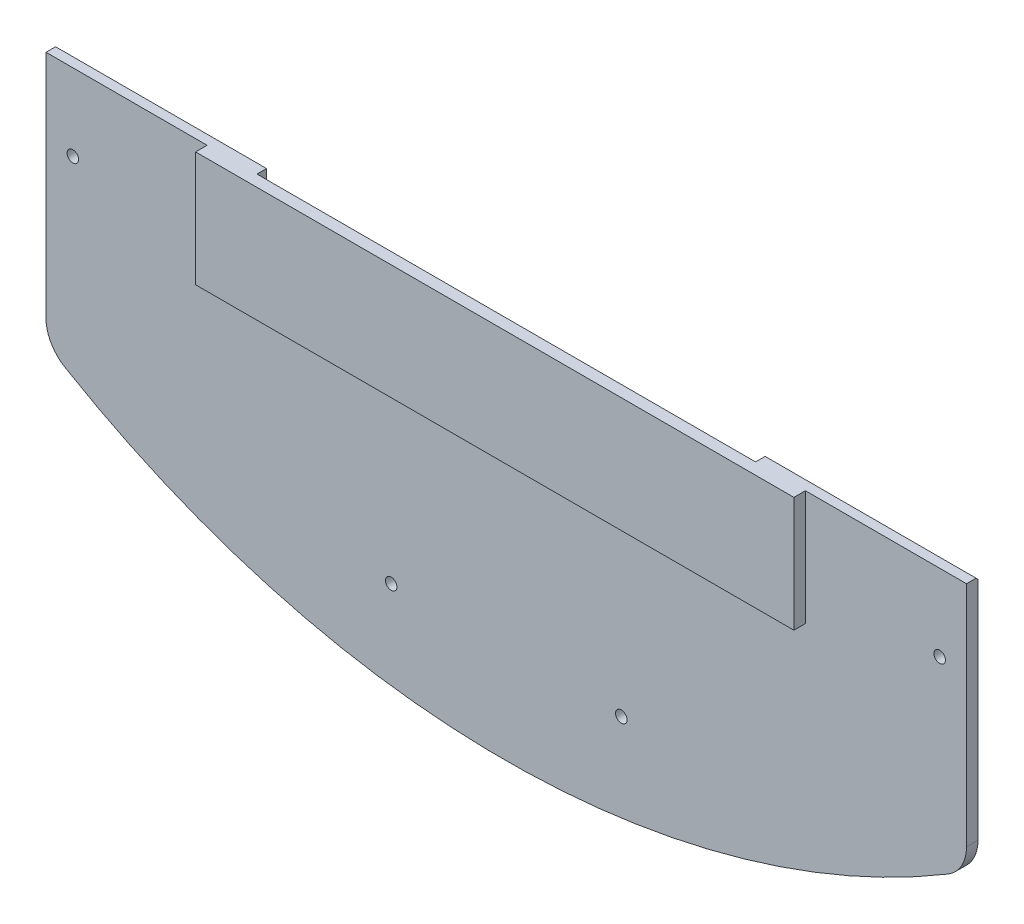
from build123d import *

# Parameters (mm, degrees)
EXTRUDE_1_DEPTH     = 3
SKETCH_2_W          = 156
SKETCH_2_H          = 30
EXTRUDE_2_DEPTH     = 3
SKETCH_3_R          = 1.5
CUT_EXTRUDE_1_DEPTH = 3
SKETCH_4_W          = 130
SKETCH_4_H          = 20
CUT_EXTRUDE_2_DEPTH = 3
FILLET_1_R          = 10
CHAMFER_1_SIZE      = 0.5


with BuildPart() as part:
    # 草图1 → 凸台-拉伸1 (new body)
    with BuildSketch(Plane.XY):
        with BuildLine():
            Line((-120, -25), (120, -25))
            Line((120, -25), (120, -90))
            ThreePointArc((120, -90), (0.09506488, -125.000515914), (-120, -90.658049905))
            Line((-120, -90.658049905), (-120, -25))
        make_face()
    extrude(amount=EXTRUDE_1_DEPTH)

    # 草图2 → 凸台-拉伸2 (add)
    with BuildSketch(Plane.XY.offset(3)):
        with Locations((0, -40)):
            Rectangle(SKETCH_2_W, SKETCH_2_H)
    extrude(amount=EXTRUDE_2_DEPTH)

    # 草图3 → 切除-拉伸1 (cut)
    with BuildSketch(Plane(origin=(0, 0, 0), x_dir=(-1, 0, 0), z_dir=(0, 0, -1))):
        with Locations((30, -100)):
            Circle(SKETCH_3_R)
        with Locations((113, -45)):
            Circle(SKETCH_3_R)
        with Locations(Location((-113, -45, 0), (0, 0, 180))):
            Circle(SKETCH_3_R)
        with Locations(Location((-30, -100, 0), (0, 0, 180))):
            Circle(SKETCH_3_R)
    extrude(amount=-CUT_EXTRUDE_1_DEPTH, mode=Mode.SUBTRACT)

    # 草图4 → 切除-拉伸2 (cut)
    with BuildSketch(Plane(origin=(0, 0, 0), x_dir=(-1, 0, 0), z_dir=(0, 0, -1))):
        with Locations((0, -35)):
            Rectangle(SKETCH_4_W, SKETCH_4_H)
    extrude(amount=-CUT_EXTRUDE_2_DEPTH, mode=Mode.SUBTRACT)

    # 圆角1
    fillet_1_edges = [part.edges().sort_by_distance(p)[0] for p in [
        (120, -90, 1.5),
        (-120, -90.658049905, 1.5),
    ]]
    fillet(fillet_1_edges, radius=FILLET_1_R)

    # 倒角1
    chamfer_1_edges = [part.edges().sort_by_distance(p)[0] for p in [
        (-92.5, -25, 0),
        (92.5, -25, 0),
        (65, -35, 0),
        (0, -45, 0),
        (-65, -35, 0),
    ]]
    chamfer(chamfer_1_edges, length=CHAMFER_1_SIZE)


solid = part.part
